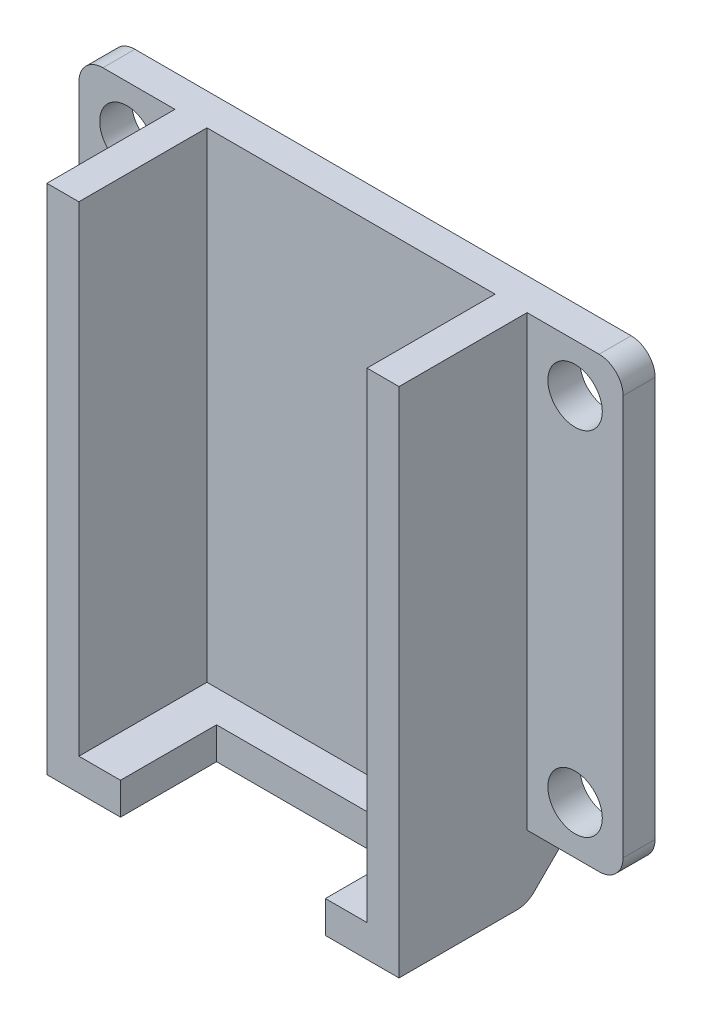
from build123d import *

# Parameters (mm, degrees)
SKETCH1_W                = 34
SKETCH1_H                = 32
BOSS_EXTRUDE1_DEPTH      = 2
BOSS_EXTRUDE2_DEPTH      = 8
SKETCH2_4_W              = 12.8
SKETCH2_4_H              = 2
BOSS_EXTRUDE3_DEPTH      = 2
SKETCH3_W                = 6
SKETCH3_H                = 4
CUT_EXTRUDE1_DEPTH       = 9
M3_CLEARANCE_HOLE1_D     = 3.4
M3_CLEARANCE_HOLE1_DEPTH = 10
M3_CLEARANCE_HOLE1_TIP   = 1.021463052
FILLET1_R                = 1.5
CHAMFER1_SIZE            = 2
FILLET2_R                = 1.5


with BuildPart() as part:
    # Sketch1 → Boss-Extrude1 (new body)
    with BuildSketch(Plane.XY):
        Rectangle(SKETCH1_W, SKETCH1_H)
    extrude(amount=BOSS_EXTRUDE1_DEPTH)

    # Sketch2 → Boss-Extrude2 (add)
    with BuildSketch(Plane.XY.offset(2)):
        Polygon((-9, 16), (-11, 16), (-11, -16), (-6.4, -16), (-6.4, -14), (-9, -14), align=None)
        Polygon((11, 16), (9, 16), (9, -14), (6.4, -14), (6.4, -16), (11, -16), align=None)
    extrude(amount=BOSS_EXTRUDE2_DEPTH)

    # Sketch2<4> → Boss-Extrude3 (add)
    with BuildSketch(Plane.XY.offset(2)):
        with Locations((0, -15)):
            Rectangle(SKETCH2_4_W, SKETCH2_4_H)
    extrude(amount=BOSS_EXTRUDE3_DEPTH)

    # Sketch3 → Cut-Extrude1 (cut)
    with BuildSketch(Plane.XY.offset(2)):
        with Locations((-14, -14)):
            Rectangle(SKETCH3_W, SKETCH3_H)
        with Locations((14, -14)):
            Rectangle(SKETCH3_W, SKETCH3_H)
    extrude(amount=-CUT_EXTRUDE1_DEPTH, mode=Mode.SUBTRACT)

    # M3 Clearance Hole1
    with Locations(Plane.XY.offset(2)):
        with Locations((-14, 13), (14, -9), (-14, -9), (14, 13)):
            Hole(M3_CLEARANCE_HOLE1_D / 2, depth=M3_CLEARANCE_HOLE1_DEPTH)
            with Locations((0, 0, -(M3_CLEARANCE_HOLE1_DEPTH + M3_CLEARANCE_HOLE1_TIP / 2))):  # 118° drill point
                Cone(0, M3_CLEARANCE_HOLE1_D / 2, M3_CLEARANCE_HOLE1_TIP, mode=Mode.SUBTRACT)

    # Fillet1
    fillet1_edges = [part.edges().sort_by_distance(p)[0] for p in [
        (-17, 16, 1),
        (17, 16, 1),
        (17, -12, 1),
        (-17, -12, 1),
    ]]
    fillet(fillet1_edges, radius=FILLET1_R)

    # Chamfer1
    chamfer1_edges = [part.edges().sort_by_distance(p)[0] for p in [
        (0, -16, 0),
    ]]
    chamfer(chamfer1_edges, length=CHAMFER1_SIZE)

    # Fillet2
    fillet2_edges = [part.edges().sort_by_distance(p)[0] for p in [
        (0, -16, 2),
    ]]
    fillet(fillet2_edges, radius=FILLET2_R)


solid = part.part
